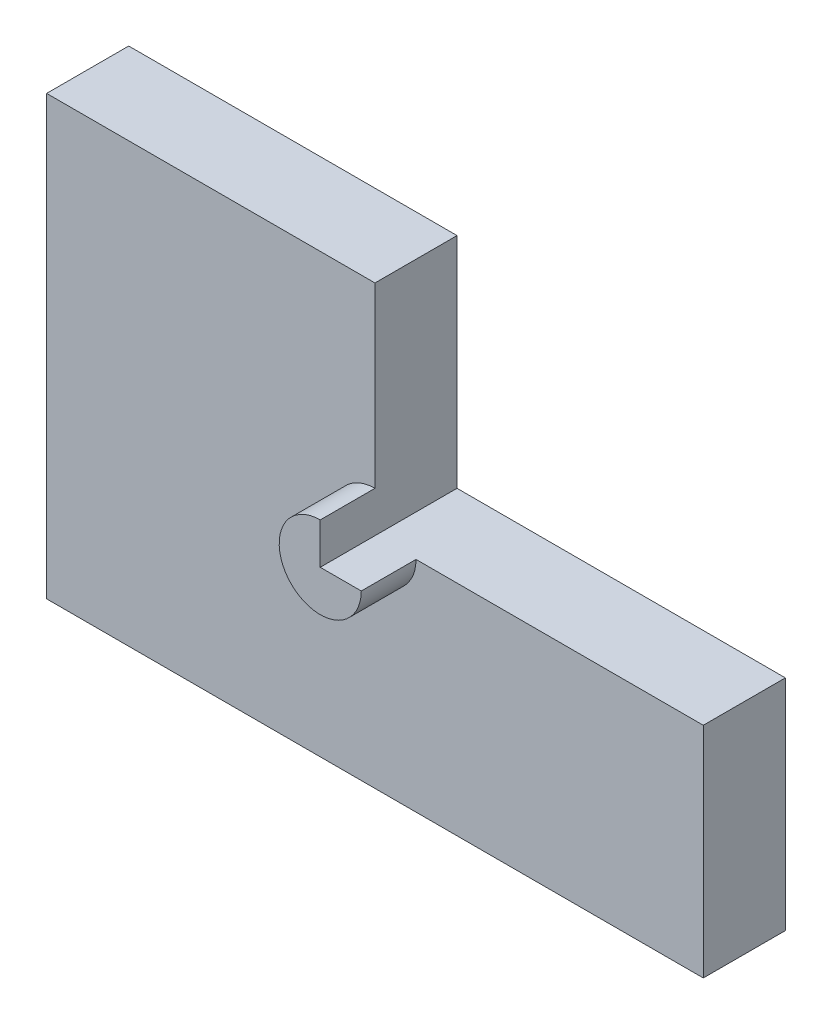
from build123d import *

# Parameters (mm, degrees)
SKETCH1_W               = 152.4
SKETCH1_H               = 101.6
BOSS_EXTRUDE1_DEPTH     = 19.05
CUT_EXTRUDE1_DEPTH      = 185.15
CUT_EXTRUDE1_DEPTH_BACK = 185.15
SKETCH4_W               = 76.2
SKETCH4_H               = 50.8
BOSS_EXTRUDE2_DEPTH     = 12.7


with BuildPart() as part:
    # Sketch1 → Boss-Extrude1 (new body)
    with BuildSketch(Plane.XY):
        with Locations((76.2, 50.8)):
            Rectangle(SKETCH1_W, SKETCH1_H)
    extrude(amount=BOSS_EXTRUDE1_DEPTH)

    # Sketch4 → Cut-Extrude1 (cut, two sides: drawn at the far end of the back side and taken through both)
    with BuildSketch(Plane.XY.offset(19.05).offset(-CUT_EXTRUDE1_DEPTH_BACK)):
        with Locations((114.3, 76.2)):
            Rectangle(SKETCH4_W, SKETCH4_H)
    extrude(amount=CUT_EXTRUDE1_DEPTH + CUT_EXTRUDE1_DEPTH_BACK, mode=Mode.SUBTRACT)

    # Sketch4<4> → Boss-Extrude2 (add)
    with BuildSketch(Plane.XY.offset(19.05)):
        with BuildLine():
            Line((76.2, 50.8), (76.2, 60.325))
            ThreePointArc((76.2, 60.325), (69.464807909, 44.064807909), (85.725, 50.8))
            Line((85.725, 50.8), (76.2, 50.8))
        make_face()
    extrude(amount=BOSS_EXTRUDE2_DEPTH)


solid = part.part
